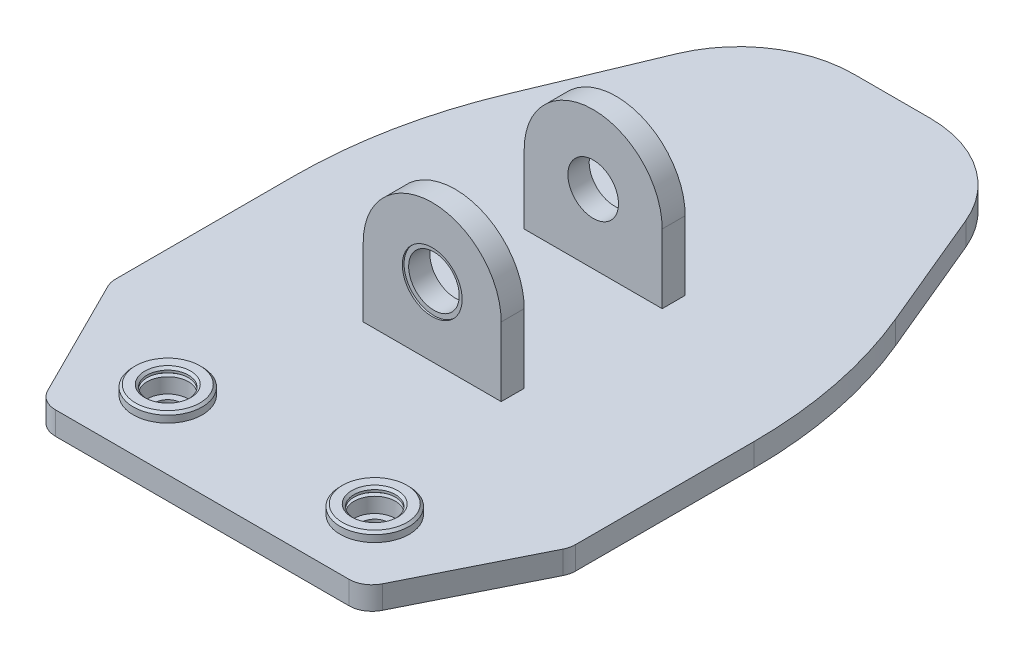
from build123d import *

# Parameters (mm, degrees)
EXTRUDE_1_DEPTH            = 10
EXTRUDE_START              = -100
EXTRUDE_3_DEPTH            = 80
SKETCH_5_W                 = 80
SKETCH_5_H                 = 60
CUT_EXTRUDE_2_DEPTH        = 110
FILLET_1_R                 = 50
FILLET_2_R                 = 200
SKETCH_7_R                 = 9
CUT_EXTRUDE_6_DEPTH        = 6
SKETCH_10_R                = 6
CUT_EXTRUDE_7_DEPTH        = 28
SKETCH_12_R                = 15
EXTRUDE_5_DEPTH            = 4
SKETCH_13_R                = 9
CUT_EXTRUDE_9_DEPTH        = 4
CUT_EXTRUDE_START          = -2
SKETCH_14_R                = 11
CUT_EXTRUDE_4144_DEPTH     = 1.5
CHAMFER_1_SIZE             = 1
CHAMFER_1_OF_MIRROR_1_SIZE = 1
SKETCH_16_R                = 13
CUT_EXTRUDE_10_DEPTH       = 0.75
CUT_EXTRUDE_START_2        = -0.75
SKETCH_17_R                = 13
CUT_EXTRUDE_11_DEPTH       = 0.75
CHAMFER_2_SIZE             = 30
CHAMFER_2_SIZE2            = 60
CHAMFER_3_SIZE             = 60
CHAMFER_3_SIZE2            = 30
FILLET_3_R                 = 10


with BuildPart() as part:
    # 草图1 → 凸台-拉伸1 (new body)
    with BuildSketch(Plane(origin=(0, 0, 0), x_dir=(1, 0, 0), z_dir=(0, 1, 0))):
        Polygon((-100, 0), (100, 0), (100, 180), (50, 300), (-50, 300), (-100, 180), align=None)
    extrude(amount=EXTRUDE_1_DEPTH)

    # 草图4 → 凸台-拉伸3 (add)
    with BuildSketch(Plane.XY.offset(EXTRUDE_START)):
        with BuildLine():
            Line((0, 29), (0, 10))
            Line((0, 10), (30, 10))
            Line((30, 10), (30, 40))
            ThreePointArc((30, 40), (21.213203436, 61.213203436), (0, 70))
            Line((0, 70), (0, 51))
            ThreePointArc((0, 51), (7.778174593, 47.778174593), (11, 40))
            ThreePointArc((11, 40), (7.778174593, 32.221825407), (0, 29))
        make_face()
        with BuildLine():
            Line((-30, 10), (0, 10))
            Line((0, 10), (0, 29))
            ThreePointArc((0, 29), (-11, 40), (0, 51))
            Line((0, 51), (0, 70))
            ThreePointArc((0, 70), (-21.213203436, 61.213203436), (-30, 40))
            Line((-30, 40), (-30, 10))
        make_face()
    extrude(amount=-EXTRUDE_3_DEPTH)

    # 草图5 → 切除-拉伸2 (cut)
    with BuildSketch(Plane(origin=(0, 10, 0), x_dir=(1, 0, 0), z_dir=(0, 1, 0))):
        with Locations((0, 140)):
            Rectangle(SKETCH_5_W, SKETCH_5_H)
    extrude(amount=CUT_EXTRUDE_2_DEPTH, mode=Mode.SUBTRACT)

    # 圆角1
    fillet_1_edges = [part.edges().sort_by_distance(p)[0] for p in [
        (-50, 5, -300),
        (50, 5, -300),
    ]]
    fillet(fillet_1_edges, radius=FILLET_1_R)

    # 圆角2
    fillet_2_edges = [part.edges().sort_by_distance(p)[0] for p in [
        (-100, 5, -180),
        (100, 5, -180),
    ]]
    fillet(fillet_2_edges, radius=FILLET_2_R)

    # 草图7 → 切除-拉伸6 (cut)
    with BuildSketch(Plane(origin=(0, 10, 0), x_dir=(1, 0, 0), z_dir=(0, 1, 0))):
        with Locations(Location((45, 30, 0), (0, 0, 270))):
            Circle(SKETCH_7_R)
    cut_extrude_6 = extrude(amount=-CUT_EXTRUDE_6_DEPTH, mode=Mode.SUBTRACT)

    # 草图10 → 切除-拉伸7 (cut)
    with BuildSketch(Plane(origin=(0, 4, 0), x_dir=(1, 0, 0), z_dir=(0, 1, 0))):
        with Locations(Location((45, 30, 0), (0, 0, 270))):
            Circle(SKETCH_10_R)
    cut_extrude_7 = extrude(amount=-CUT_EXTRUDE_7_DEPTH, mode=Mode.SUBTRACT)

    # 草图12 → 凸台-拉伸5 (add)
    with BuildSketch(Plane(origin=(0, 10, 0), x_dir=(1, 0, 0), z_dir=(0, 1, 0))):
        with Locations(Location((45, 30, 0), (0, 0, 270))):
            Circle(SKETCH_12_R)
    extrude_5 = extrude(amount=EXTRUDE_5_DEPTH)

    # 草图13 → 切除-拉伸9 (cut)
    with BuildSketch(Plane(origin=(0, 14, 0), x_dir=(1, 0, 0), z_dir=(0, 1, 0))):
        with Locations(Location((45, 30, 0), (0, 0, 270))):
            Circle(SKETCH_13_R)
    cut_extrude_9 = extrude(amount=-CUT_EXTRUDE_9_DEPTH, mode=Mode.SUBTRACT)

    # 草图14 → Cut-Extrude 4144 (cut)
    with BuildSketch(Plane(origin=(0, 14, 0), x_dir=(1, 0, 0), z_dir=(0, 1, 0)).offset(CUT_EXTRUDE_START)):
        with Locations(Location((45, 30, 0), (0, 0, 270))):
            Circle(SKETCH_14_R)
    cut_extrude_4144 = extrude(amount=-CUT_EXTRUDE_4144_DEPTH, mode=Mode.SUBTRACT)

    # 倒角1
    chamfer_1_edges = [part.edges().sort_by_distance(p)[0] for p in [
        (45, 14, -45),
        (45, 14, -39),
    ]]
    chamfer(chamfer_1_edges, length=CHAMFER_1_SIZE)

    # 镜向1: 切除-拉伸6, 切除-拉伸7, 凸台-拉伸5, 切除-拉伸9, Cut-Extrude 4144 across plane
    add(cut_extrude_6.mirror(Plane.ZY), mode=Mode.SUBTRACT)
    add(cut_extrude_7.mirror(Plane.ZY), mode=Mode.SUBTRACT)
    add(extrude_5.mirror(Plane.ZY))
    add(cut_extrude_9.mirror(Plane.ZY), mode=Mode.SUBTRACT)
    add(cut_extrude_4144.mirror(Plane.ZY), mode=Mode.SUBTRACT)

    # 倒角1 of 镜向1
    chamfer_1_of_mirror_1_edges = [part.edges().sort_by_distance(p)[0] for p in [
        (-45, 14, -45),
        (-45, 14, -39),
    ]]
    chamfer(chamfer_1_of_mirror_1_edges, length=CHAMFER_1_OF_MIRROR_1_SIZE)

    # 草图16 → 切除-拉伸10 (cut)
    with BuildSketch(Plane.XY.offset(-100)):
        with Locations((0, 40)):
            Circle(SKETCH_16_R)
    extrude(amount=-CUT_EXTRUDE_10_DEPTH, mode=Mode.SUBTRACT)

    # 草图17 → 切除-拉伸11 (cut)
    with BuildSketch(Plane(origin=(0, 0, -180), x_dir=(-1, 0, 0), z_dir=(0, 0, -1)).offset(CUT_EXTRUDE_START_2)):
        with Locations(Location((0, 40, 0), (0, 0, 180))):
            Circle(SKETCH_17_R)
    extrude(amount=CUT_EXTRUDE_11_DEPTH, mode=Mode.SUBTRACT)

    # 倒角2
    chamfer_2_edges = [part.edges().sort_by_distance(p)[0] for p in [
        (100, 5, 0),
    ]]
    chamfer_2_side = [part.faces().sort_by_distance(p)[0] for p in [
        (0, 5, 0),
    ]]
    chamfer(chamfer_2_edges, length=CHAMFER_2_SIZE, length2=CHAMFER_2_SIZE2, reference=chamfer_2_side[0])

    # 倒角3
    chamfer_3_edges = [part.edges().sort_by_distance(p)[0] for p in [
        (-100, 5, 0),
    ]]
    chamfer_3_side = [part.faces().sort_by_distance(p)[0] for p in [
        (-100, 5, -70),
    ]]
    chamfer(chamfer_3_edges, length=CHAMFER_3_SIZE, length2=CHAMFER_3_SIZE2, reference=chamfer_3_side[0])

    # 圆角3
    fillet_3_edges = [part.edges().sort_by_distance(p)[0] for p in [
        (100, 5, -60),
        (70, 5, 0),
        (-70, 5, 0),
        (-100, 5, -60),
    ]]
    fillet(fillet_3_edges, radius=FILLET_3_R)


solid = part.part
